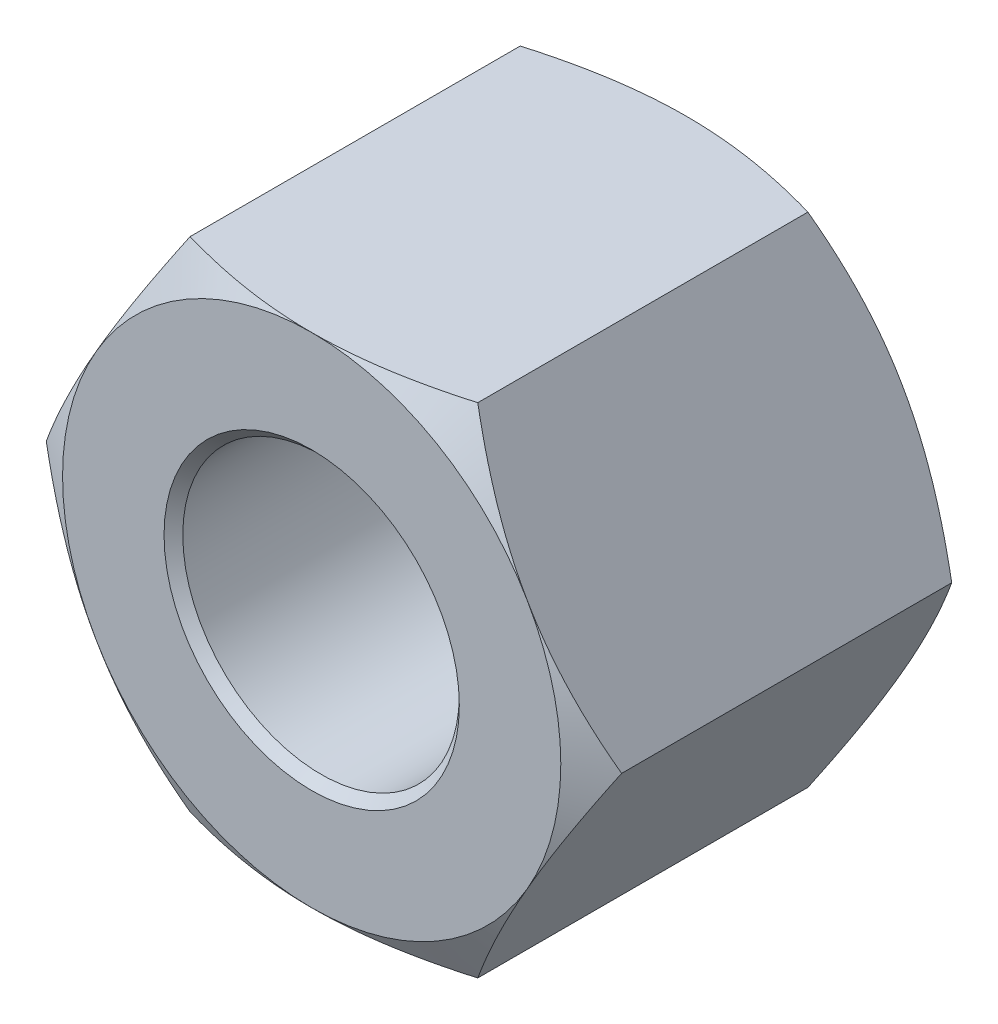
from build123d import *

# Parameters (mm, degrees)
SKETCH_1_R          = 2.067
EXTRUDE_466_DEPTH   = 5.6
SKETCH_2_OUTSIDE_W  = 44.252
SKETCH_2_OUTSIDE_H  = 43.1
SKETCH_2_OUTSIDE_R  = 3.723909236
CUT_EXTRUDE_1_DEPTH = 8.982324223
CUT_EXTRUDE_1_DRAFT = -60
SKETCH_3_OUTSIDE_W  = 44.252
SKETCH_3_OUTSIDE_H  = 43.1
SKETCH_3_OUTSIDE_R  = 3.723909236
CUT_EXTRUDE_2_DEPTH = 8.982324223
CUT_EXTRUDE_2_DRAFT = -60
CHAMFER_1_SIZE      = 0.14


with BuildPart() as part:
    # 草图1 → Extrude 466 (new body)
    with BuildSketch(Plane.XY):
        Polygon((2.15, 3.723909236), (-2.15, 3.723909236), (-4.3, 0), (-2.15, -3.723909236), (2.15, -3.723909236), (4.3, 0), align=None)
        Circle(SKETCH_1_R, mode=Mode.SUBTRACT)
    extrude(amount=EXTRUDE_466_DEPTH)


with BuildPart() as cut_extrude_1_tool:
    # 草图2 outside → 切除-拉伸1 (with draft: the straight prism first)
    with BuildSketch(Plane(origin=(0, 0, 0), x_dir=(-1, 0, 0), z_dir=(0, 0, -1))):
        Rectangle(SKETCH_2_OUTSIDE_W, SKETCH_2_OUTSIDE_H)
        Circle(SKETCH_2_OUTSIDE_R, mode=Mode.SUBTRACT)
    extrude(amount=-CUT_EXTRUDE_1_DEPTH)
    # 切除-拉伸1: the draft: its side faces are tilted about the plane it starts from
    cut_extrude_1_sides = [cut_extrude_1_tool.faces().sort_by_distance(p)[0] for p in [
        (0, -21.55, 4.491162111),
        (-22.126, 0, 4.491162111),
        (0, 21.55, 4.491162111),
        (22.126, 0, 4.491162111),
        (3.723909236, 0, 4.491162111),
    ]]
    draft(cut_extrude_1_sides, Plane(origin=(0, 0, 0), x_dir=(-1, 0, 0), z_dir=(0, 0, -1)), CUT_EXTRUDE_1_DRAFT)


with BuildPart() as part_1:
    add(part.part)

    # 切除-拉伸1: cut by cut_extrude_1_tool
    add(cut_extrude_1_tool.part, mode=Mode.SUBTRACT)


with BuildPart() as cut_extrude_2_tool:
    # 草图3 outside → 切除-拉伸2 (with draft: the straight prism first)
    with BuildSketch(Plane.XY.offset(5.6)):
        Rectangle(SKETCH_3_OUTSIDE_W, SKETCH_3_OUTSIDE_H)
        Circle(SKETCH_3_OUTSIDE_R, mode=Mode.SUBTRACT)
    extrude(amount=-CUT_EXTRUDE_2_DEPTH)
    # 切除-拉伸2: the draft: its side faces are tilted about the plane it starts from
    cut_extrude_2_sides = [cut_extrude_2_tool.faces().sort_by_distance(p)[0] for p in [
        (0, -21.55, 1.108837889),
        (22.126, 0, 1.108837889),
        (0, 21.55, 1.108837889),
        (-22.126, 0, 1.108837889),
        (-3.723909236, 0, 1.108837889),
    ]]
    draft(cut_extrude_2_sides, Plane.XY.offset(5.6), CUT_EXTRUDE_2_DRAFT)


with BuildPart() as part_2:
    add(part_1.part)

    # 切除-拉伸2: cut by cut_extrude_2_tool
    add(cut_extrude_2_tool.part, mode=Mode.SUBTRACT)

    # 倒角1
    chamfer_1_edges = [part_2.edges().sort_by_distance(p)[0] for p in [
        (-2.067, 0, 0),
        (-2.067, 0, 5.6),
    ]]
    chamfer(chamfer_1_edges, length=CHAMFER_1_SIZE)


solid = part_2.part
